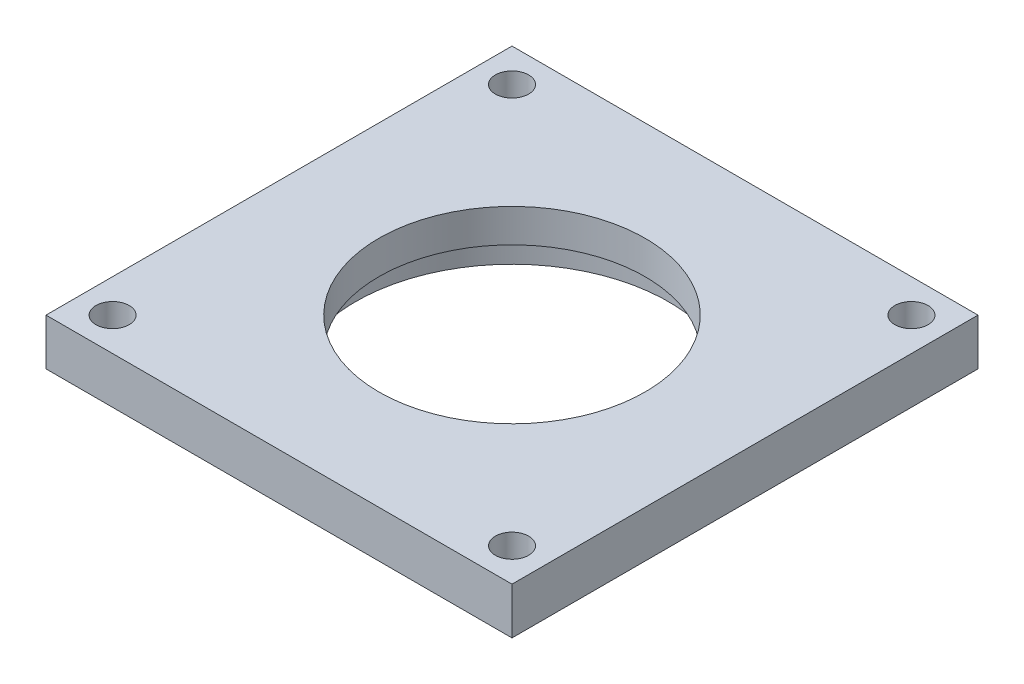
from build123d import *

# Parameters (mm, degrees)
SZKIC1_W                    = 70
SZKIC1_H                    = 70
SZKIC1_R                    = 2.5
SZKIC1_R_2                  = 20
DODANIE_WYCI_GNI_CIE1_DEPTH = 10
SZKIC1_3_W                  = 70
SZKIC1_3_H                  = 70
SZKIC1_3_R                  = 2.5
WYTNIJ_WYCI_GNI_CIE1_DEPTH  = 3
SZKIC1_4_R                  = 23.5
SZKIC1_4_R_2                = 20
WYTNIJ_WYCI_GNI_CIE2_DEPTH  = 5


with BuildPart() as part:
    # Szkic1 → Dodanie-wyciągnięcie1 (new body)
    with BuildSketch(Plane(origin=(0, 0, 0), x_dir=(1, 0, 0), z_dir=(0, 1, 0))):
        with Locations((35, 35)):
            Rectangle(SZKIC1_W, SZKIC1_H)
        with Locations((5, 5)):
            Circle(SZKIC1_R, mode=Mode.SUBTRACT)
        with Locations((65, 5)):
            Circle(SZKIC1_R, mode=Mode.SUBTRACT)
        with Locations((5, 65)):
            Circle(SZKIC1_R, mode=Mode.SUBTRACT)
        with Locations((65, 65)):
            Circle(SZKIC1_R, mode=Mode.SUBTRACT)
        with Locations((35, 35)):
            Circle(SZKIC1_R_2, mode=Mode.SUBTRACT)
    extrude(amount=DODANIE_WYCI_GNI_CIE1_DEPTH)

    # Szkic1<3> → Wytnij-wyciągnięcie1 (cut)
    with BuildSketch(Plane(origin=(0, 0, 0), x_dir=(1, 0, 0), z_dir=(0, 1, 0))):
        with Locations((35, 35)):
            Rectangle(SZKIC1_3_W, SZKIC1_3_H)
        with Locations((5, 5)):
            Circle(SZKIC1_3_R, mode=Mode.SUBTRACT)
        with Locations((65, 5)):
            Circle(SZKIC1_3_R, mode=Mode.SUBTRACT)
        with Locations((5, 65)):
            Circle(SZKIC1_3_R, mode=Mode.SUBTRACT)
        with BuildLine():
            Line((5, 15), (5, 35))
            Line((5, 35), (5, 55))
            ThreePointArc((5, 55), (7.928932188, 62.071067812), (15, 65))
            Line((15, 65), (55, 65))
            ThreePointArc((55, 65), (62.071067812, 62.071067812), (65, 55))
            Line((65, 55), (65, 15))
            ThreePointArc((65, 15), (62.071067812, 7.928932188), (55, 5))
            Line((55, 5), (15, 5))
            ThreePointArc((15, 5), (7.928932188, 7.928932188), (5, 15))
        make_face(mode=Mode.SUBTRACT)
        with Locations((65, 65)):
            Circle(SZKIC1_3_R, mode=Mode.SUBTRACT)
    extrude(amount=WYTNIJ_WYCI_GNI_CIE1_DEPTH, mode=Mode.SUBTRACT)

    # Szkic1<4> → Wytnij-wyciągnięcie2 (cut)
    with BuildSketch(Plane(origin=(0, 0, 0), x_dir=(1, 0, 0), z_dir=(0, 1, 0))):
        with Locations((35, 35)):
            Circle(SZKIC1_4_R)
        with Locations((35, 35)):
            Circle(SZKIC1_4_R_2, mode=Mode.SUBTRACT)
    extrude(amount=WYTNIJ_WYCI_GNI_CIE2_DEPTH, mode=Mode.SUBTRACT)


solid = part.part
